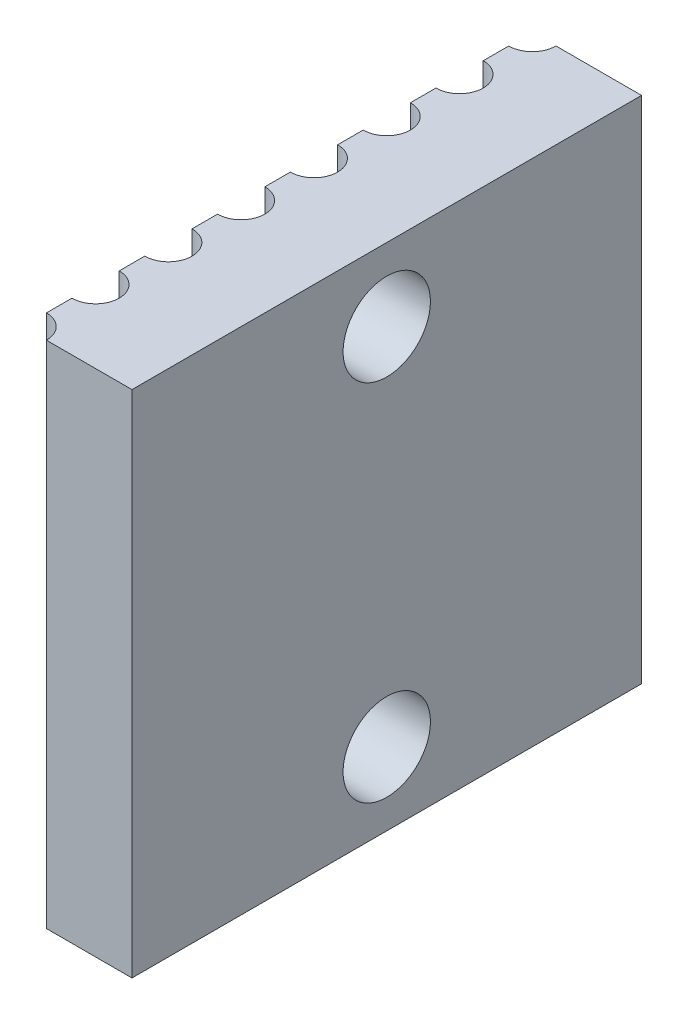
from build123d import *

# Parameters (mm, degrees)
SKETCH1_W            = 3
SKETCH1_H            = 14
BOSS_EXTRUDE1_DEPTH  = 14
SKETCH2_R            = 0.65
CUT_EXTRUDE1_DEPTH   = 21.024984395
M2_CLEARANCE_HOLE1_D = 2.4


with BuildPart() as part:
    # Sketch1 → Boss-Extrude1 (new body)
    with BuildSketch(Plane(origin=(0, 0, 0), x_dir=(1, 0, 0), z_dir=(0, 1, 0))):
        with Locations((1.5, -7)):
            Rectangle(SKETCH1_W, SKETCH1_H)
    extrude(amount=BOSS_EXTRUDE1_DEPTH)

    # Sketch2 → Cut-Extrude1 (cut, through all)
    with BuildSketch(Plane(origin=(0, 0, 0), x_dir=(1, 0, 0), z_dir=(0, 1, 0))):
        Circle(SKETCH2_R)
        with Locations((0, -2)):
            Circle(SKETCH2_R)
        with Locations((0, -4)):
            Circle(SKETCH2_R)
        with Locations((0, -6)):
            Circle(SKETCH2_R)
        with Locations((0, -8)):
            Circle(SKETCH2_R)
        with Locations((0, -10)):
            Circle(SKETCH2_R)
        with Locations((0, -12)):
            Circle(SKETCH2_R)
        with Locations((0, -14)):
            Circle(SKETCH2_R)
    extrude(amount=CUT_EXTRUDE1_DEPTH, mode=Mode.SUBTRACT)

    # M2 Clearance Hole1 (through all)
    with Locations(Plane(origin=(3, 0, 0), x_dir=(0, 0, -1), z_dir=(1, 0, 0))):
        with Locations((-7, 12), (-7, 2)):
            Hole(M2_CLEARANCE_HOLE1_D / 2)


solid = part.part
